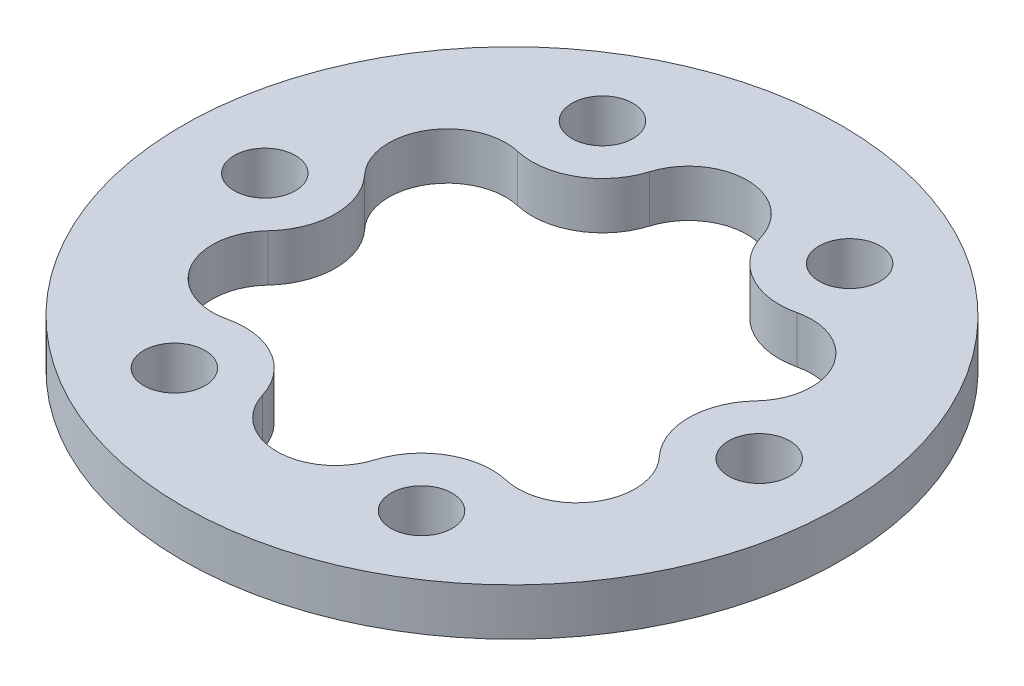
from build123d import *

# Parameters (mm, degrees)
SKETCH_1_R               = 28
SKETCH_1_R_2             = 2.6
EXTRUDE_1_DEPTH          = 4
CUT_EXTRUDE_2_DEPTH      = 40.799497484
CUT_EXTRUDE_2_DEPTH_BACK = 40.799497484


with BuildPart() as part:
    # 草图1 → 凸台-拉伸1 (new body)
    with BuildSketch(Plane(origin=(0, 0, 0), x_dir=(1, 0, 0), z_dir=(0, 1, 0))):
        with Locations(Location((0, 0, 0), (0, 0, 270))):
            Circle(SKETCH_1_R)
        with Locations(Location((10.5, 18.186533479, 0), (0, 0, 270))):
            Circle(SKETCH_1_R_2, mode=Mode.SUBTRACT)
        with Locations(Location((21, 0, 0), (0, 0, 270))):
            Circle(SKETCH_1_R_2, mode=Mode.SUBTRACT)
        with Locations(Location((10.5, -18.186533479, 0), (0, 0, 270))):
            Circle(SKETCH_1_R_2, mode=Mode.SUBTRACT)
        with Locations(Location((-10.5, -18.186533479, 0), (0, 0, 270))):
            Circle(SKETCH_1_R_2, mode=Mode.SUBTRACT)
        with Locations(Location((-21, 0, 0), (0, 0, 270))):
            Circle(SKETCH_1_R_2, mode=Mode.SUBTRACT)
        with Locations(Location((-10.5, 18.186533479, 0), (0, 0, 270))):
            Circle(SKETCH_1_R_2, mode=Mode.SUBTRACT)
    extrude(amount=EXTRUDE_1_DEPTH)

    # 草图4 → 切除-拉伸2 (cut, two sides: drawn at the far end of the back side and taken through both)
    with BuildSketch(Plane(origin=(0, 4, 0), x_dir=(1, 0, 0), z_dir=(0, 1, 0)).offset(-CUT_EXTRUDE_2_DEPTH_BACK)):
        with BuildLine():
            ThreePointArc((4.758569662, 16.444127766), (7.499999998, 12.990381058), (11.861747553, 12.343106095))
            ThreePointArc((11.861747553, 12.343106095), (17.297017524, 9.986437726), (16.620317219, 4.10102167))
            ThreePointArc((16.620317219, 4.10102167), (15, 2e-09), (16.620317216, -4.101021667))
            ThreePointArc((16.620317216, -4.101021667), (17.297017526, -9.986437723), (11.861747557, -12.343106096))
            ThreePointArc((11.861747557, -12.343106096), (7.500000002, -12.990381056), (4.758569663, -16.444127762))
            ThreePointArc((4.758569663, -16.444127762), (2e-09, -19.972875449), (-4.758569662, -16.444127766))
            ThreePointArc((-4.758569662, -16.444127766), (-7.499999998, -12.990381058), (-11.861747553, -12.343106095))
            ThreePointArc((-11.861747553, -12.343106095), (-17.297017524, -9.986437726), (-16.620317219, -4.10102167))
            ThreePointArc((-16.620317219, -4.10102167), (-15, -2e-09), (-16.620317216, 4.101021667))
            ThreePointArc((-16.620317216, 4.101021667), (-17.297017526, 9.986437723), (-11.861747557, 12.343106096))
            ThreePointArc((-11.861747557, 12.343106096), (-7.500000002, 12.990381056), (-4.758569663, 16.444127762))
            ThreePointArc((-4.758569663, 16.444127762), (-2e-09, 19.972875449), (4.758569662, 16.444127766))
        make_face()
    extrude(amount=CUT_EXTRUDE_2_DEPTH + CUT_EXTRUDE_2_DEPTH_BACK, mode=Mode.SUBTRACT)


solid = part.part
